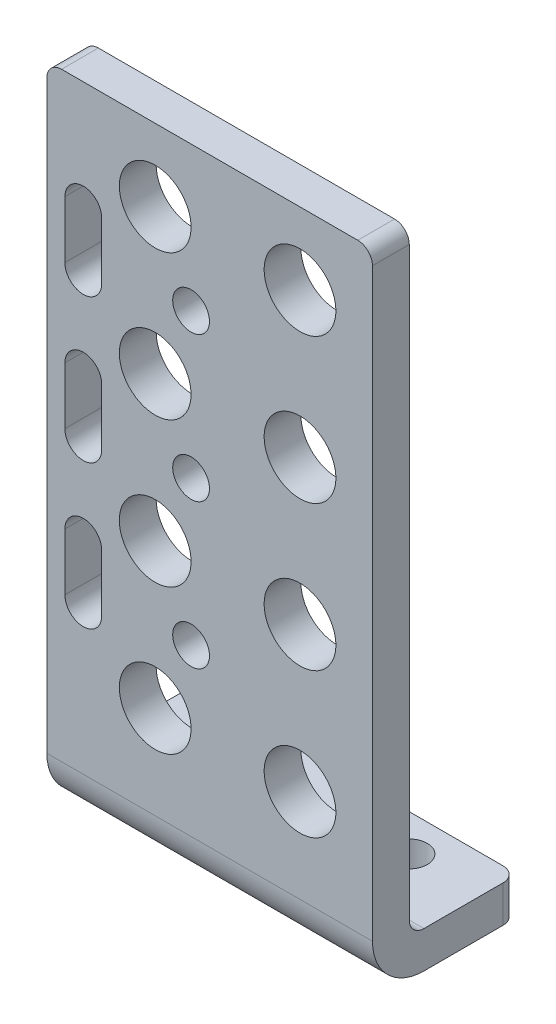
from build123d import *

# Parameters (mm, degrees)
BOSS_EXTRUDE6_DEPTH = 44.958
SKETCH12_R          = 4.953
SKETCH12_R_2        = 2.54
CUT_EXTRUDE1_DEPTH  = 102.639997127
FILLET4_R           = 2.032
FILLET5_R           = 2.032
FILLET6_R           = 2.032
FILLET7_R           = 2.032
SKETCH15_R          = 2.54
CUT_EXTRUDE2_DEPTH  = 99.086762695


with BuildPart() as part:
    # Sketch6 → Boss-Extrude6 (new body)
    with BuildSketch(Plane(origin=(0, 0, 0), x_dir=(0, 0, -1), z_dir=(1, 0, 0))):
        with BuildLine():
            Line((0, 7.112), (0, 89.916))
            Line((0, 89.916), (5.08, 89.916))
            Line((5.08, 89.916), (5.08, 7.112))
            ThreePointArc((5.08, 7.112), (5.675159021, 5.675159021), (7.112, 5.08))
            Line((7.112, 5.08), (20.066, 5.08))
            Line((20.066, 5.08), (20.066, 0))
            Line((20.066, 0), (7.112, 0))
            ThreePointArc((7.112, 0), (2.083056572, 2.083056572), (0, 7.112))
        make_face()
    extrude(amount=BOSS_EXTRUDE6_DEPTH)

    # Sketch12 → Cut-Extrude1 (cut, through all)
    with BuildSketch(Plane(origin=(0, 0, -5.08), x_dir=(-1, 0, 0), z_dir=(0, 0, -1))):
        with Locations((-34.9504, 79.9592)):
            Circle(SKETCH12_R)
        with Locations((-14.9606, 79.9592)):
            Circle(SKETCH12_R)
        with Locations((-14.9606, 59.9694)):
            Circle(SKETCH12_R)
        with Locations((-14.9606, 39.9796)):
            Circle(SKETCH12_R)
        with Locations((-14.9606, 19.9898)):
            Circle(SKETCH12_R)
        with Locations((-34.9504, 59.9694)):
            Circle(SKETCH12_R)
        with Locations((-34.9504, 39.9796)):
            Circle(SKETCH12_R)
        with Locations((-34.9504, 19.9898)):
            Circle(SKETCH12_R)
        with Locations((-19.9136, 49.9745)):
            Circle(SKETCH12_R_2)
        with Locations((-19.9136, 69.9643)):
            Circle(SKETCH12_R_2)
        with Locations((-19.9136, 29.9847)):
            Circle(SKETCH12_R_2)
        with BuildLine():
            Line((-2.4892, 74.9046), (-2.4892, 67.0306))
            ThreePointArc((-2.4892, 67.0306), (-5.0292, 64.4906), (-7.5692, 67.0306))
            Line((-7.5692, 67.0306), (-7.5692, 74.9046))
            ThreePointArc((-7.5692, 74.9046), (-5.0292, 77.4446), (-2.4892, 74.9046))
        make_face()
        with BuildLine():
            Line((-2.4892, 55.0418), (-2.4892, 47.1678))
            ThreePointArc((-2.4892, 47.1678), (-5.0292, 44.6278), (-7.5692, 47.1678))
            Line((-7.5692, 47.1678), (-7.5692, 55.0418))
            ThreePointArc((-7.5692, 55.0418), (-5.0292, 57.5818), (-2.4892, 55.0418))
        make_face()
        with BuildLine():
            Line((-2.4892, 35.179), (-2.4892, 27.305))
            ThreePointArc((-2.4892, 27.305), (-5.0292, 24.765), (-7.5692, 27.305))
            Line((-7.5692, 27.305), (-7.5692, 35.179))
            ThreePointArc((-7.5692, 35.179), (-5.0292, 37.719), (-2.4892, 35.179))
        make_face()
    extrude(amount=-CUT_EXTRUDE1_DEPTH, mode=Mode.SUBTRACT)

    # Fillet4
    fillet4_edges = [part.edges().sort_by_distance(p)[0] for p in [
        (44.958, 89.916, -2.54),
    ]]
    fillet(fillet4_edges, radius=FILLET4_R)

    # Fillet5
    fillet5_edges = [part.edges().sort_by_distance(p)[0] for p in [
        (44.958, 2.54, -20.066),
    ]]
    fillet(fillet5_edges, radius=FILLET5_R)

    # Fillet6
    fillet6_edges = [part.edges().sort_by_distance(p)[0] for p in [
        (0, 2.54, -20.066),
    ]]
    fillet(fillet6_edges, radius=FILLET6_R)

    # Fillet7
    fillet7_edges = [part.edges().sort_by_distance(p)[0] for p in [
        (0, 89.916, -2.54),
    ]]
    fillet(fillet7_edges, radius=FILLET7_R)

    # Sketch15 → Cut-Extrude2 (cut, through all)
    with BuildSketch(Plane(origin=(0, 5.08, 0), x_dir=(1, 0, 0), z_dir=(0, 1, 0))):
        with Locations(Location((15.0114, 14.986, 0), (0, 0, 270))):
            Circle(SKETCH15_R)
        with Locations(Location((35.0012, 14.986, 0), (0, 0, 270))):
            Circle(SKETCH15_R)
    extrude(amount=-CUT_EXTRUDE2_DEPTH, mode=Mode.SUBTRACT)


solid = part.part
